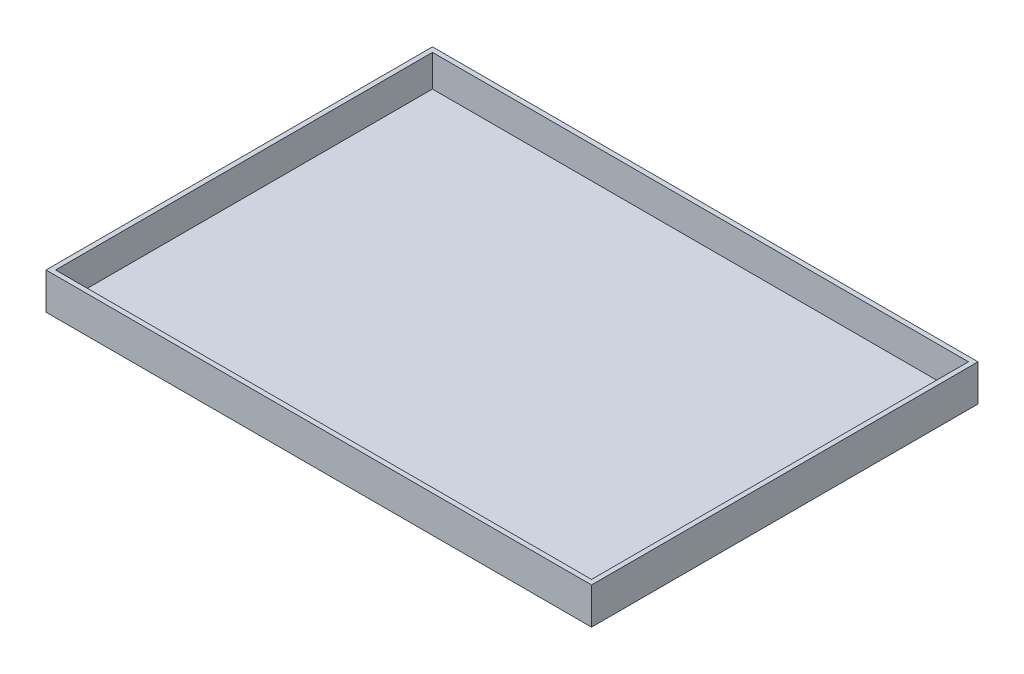
from build123d import *

# Parameters (mm, degrees)
SKETCH1_W           = 343
SKETCH1_H           = 243
SKETCH1_W_2         = 337
SKETCH1_H_2         = 237
BOSS_EXTRUDE1_DEPTH = 23
SKETCH2_W           = 343
SKETCH2_H           = 243
BOSS_EXTRUDE2_DEPTH = 3


with BuildPart() as part:
    # Sketch1 → Boss-Extrude1 (new body)
    with BuildSketch(Plane(origin=(0, 0, 0), x_dir=(1, 0, 0), z_dir=(0, 1, 0))):
        Rectangle(SKETCH1_W, SKETCH1_H)
        Rectangle(SKETCH1_W_2, SKETCH1_H_2, mode=Mode.SUBTRACT)
    extrude(amount=BOSS_EXTRUDE1_DEPTH)

    # Sketch2 → Boss-Extrude2 (add)
    with BuildSketch(Plane.XZ):
        Rectangle(SKETCH2_W, SKETCH2_H)
    extrude(amount=-BOSS_EXTRUDE2_DEPTH)


solid = part.part
